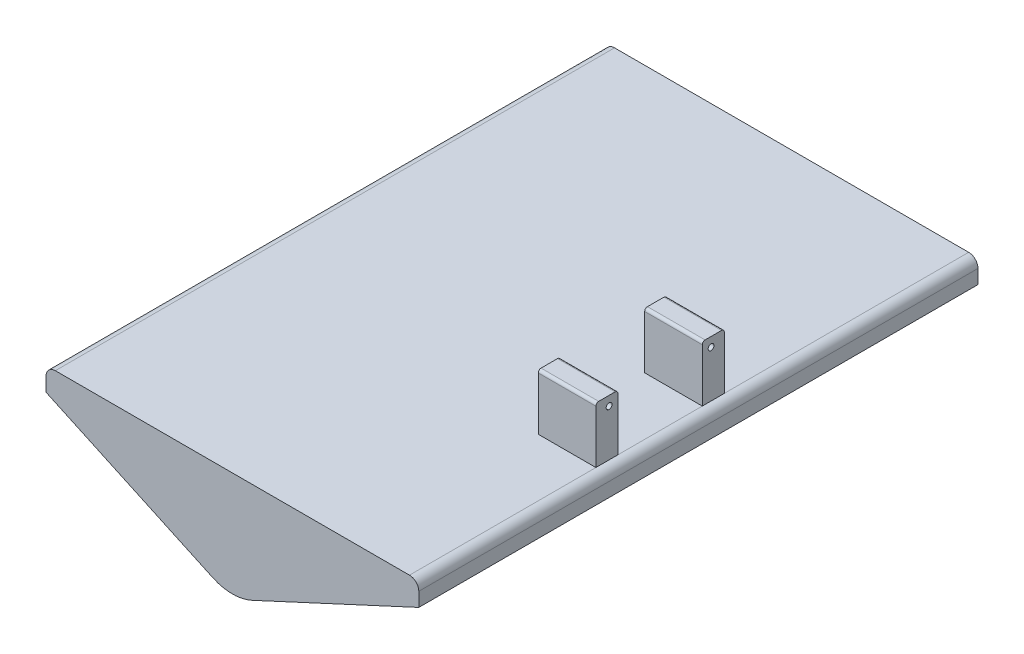
from build123d import *

# Parameters (mm, degrees)
SKETCH2_W               = 101.6
SKETCH2_H               = 6.35
BOSS_EXTRUDE1_DEPTH     = 152.4
CUT_EXTRUDE1_START      = -6.35
SKETCH3_R               = 6.985
CUT_EXTRUDE1_DEPTH      = 157.289355631
CUT_EXTRUDE2_START      = -6.35
SKETCH4_W               = 101.6
SKETCH4_H               = 38.1
CUT_EXTRUDE2_DEPTH      = 157.815347501
FILLET4_R               = 2.54
SKETCH5_W               = 15.7
SKETCH5_H               = 6
BOSS_EXTRUDE2_DEPTH     = 15.24
SKETCH6_R               = 0.8
CUT_EXTRUDE4_DEPTH      = 176.555716512
FILLET7_R               = 0.762
FILLET8_R               = 0.762
TAP_DRILL_FOR_M2_TAP3_D = 1.6


with BuildPart() as part:
    # Sketch2 → Boss-Extrude1 (new body)
    with BuildSketch(Plane.XY):
        with BuildLine():
            Line((-50.8, -3.175), (-5.335878714, -24.224686475))
            ThreePointArc((-5.335878714, -24.224686475), (0, -25.4), (5.335878714, -24.224686475))
            Line((5.335878714, -24.224686475), (50.8, -3.175))
            Line((50.8, -3.175), (-50.8, -3.175))
        make_face()
        Rectangle(SKETCH2_W, SKETCH2_H)
    extrude(amount=BOSS_EXTRUDE1_DEPTH)

    # Sketch3 → Cut-Extrude1 (cut, through all)
    with BuildSketch(Plane.XY.offset(152.4).offset(CUT_EXTRUDE1_START)):
        with Locations((0, -12.7)):
            Circle(SKETCH3_R)
    extrude(amount=-CUT_EXTRUDE1_DEPTH, mode=Mode.SUBTRACT)

    # Sketch4 → Cut-Extrude2 (cut, through all)
    with BuildSketch(Plane(origin=(0, 3.175, 0), x_dir=(1, 0, 0), z_dir=(0, 1, 0)).offset(CUT_EXTRUDE2_START)):
        with Locations((0, -76.2)):
            Rectangle(SKETCH4_W, SKETCH4_H)
    extrude(amount=-CUT_EXTRUDE2_DEPTH, mode=Mode.SUBTRACT)

    # Fillet4
    fillet4_edges = [part.edges().sort_by_distance(p)[0] for p in [
        (-50.8, 3.175, 76.2),
        (50.8, 3.175, 76.2),
    ]]
    fillet(fillet4_edges, radius=FILLET4_R)

    # Sketch5 → Boss-Extrude2 (add)
    with BuildSketch(Plane(origin=(0, 3.175, 0), x_dir=(1, 0, 0), z_dir=(0, 1, 0))):
        with Locations((40.41, -98.6)):
            Rectangle(SKETCH5_W, SKETCH5_H)
        with Locations((40.41, -69.6)):
            Rectangle(SKETCH5_W, SKETCH5_H)
    extrude(amount=BOSS_EXTRUDE2_DEPTH)

    # Sketch6 → Cut-Extrude4 (cut, through all)
    with BuildSketch(Plane.ZY.offset(-32.56)):
        with Locations((97.995000084, 15.875)):
            Circle(SKETCH6_R)
        with Locations((70.204999916, 15.875)):
            Circle(SKETCH6_R)
    extrude(amount=-CUT_EXTRUDE4_DEPTH, mode=Mode.SUBTRACT)

    # Fillet7
    fillet7_edges = [part.edges().sort_by_distance(p)[0] for p in [
        (40.41, 18.415, 95.6),
        (40.41, 18.415, 101.6),
    ]]
    fillet(fillet7_edges, radius=FILLET7_R)

    # Fillet8
    fillet8_edges = [part.edges().sort_by_distance(p)[0] for p in [
        (40.41, 18.415, 66.6),
        (40.41, 18.415, 72.6),
    ]]
    fillet(fillet8_edges, radius=FILLET8_R)

    # Tap Drill for M2 Tap3 (through all)
    with Locations(Plane.ZY.offset(-32.56)):
        with Locations((97.995000084, 15.875), (70.204999916, 15.875)):
            Hole(TAP_DRILL_FOR_M2_TAP3_D / 2)


solid = part.part
